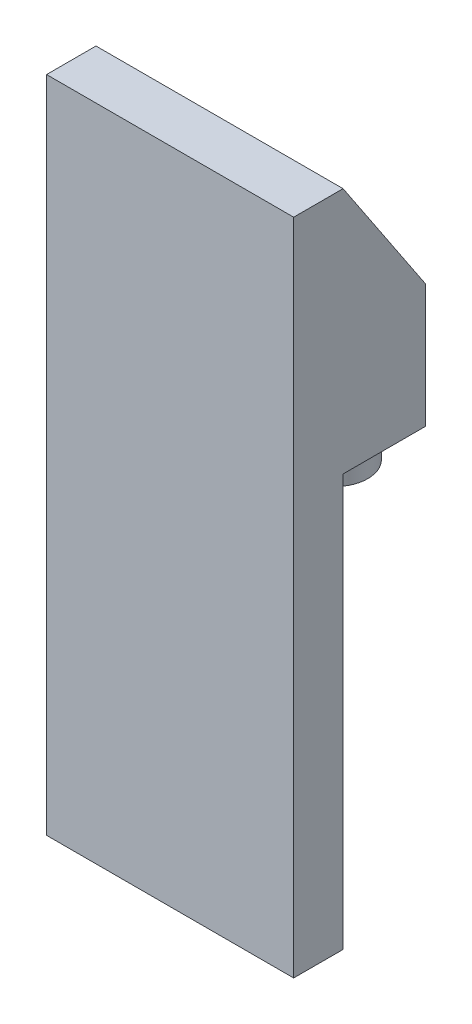
from build123d import *

# Parameters (mm, degrees)
SKETCH1_W           = 15
SKETCH1_H           = 40
BOSS_EXTRUDE2_DEPTH = 3
SKETCH2_W           = 15
SKETCH2_H           = 15
BOSS_EXTRUDE5_DEPTH = 5
CUT_EXTRUDE9_DEPTH  = 15
SKETCH14_W          = 11
SKETCH14_H          = 0.5
CUT_EXTRUDE10_DEPTH = 5
BOSS_EXTRUDE9_DEPTH = 2
SKETCH18_R          = 1.5
CUT_EXTRUDE11_DEPTH = 10


with BuildPart() as part:
    # Sketch1 → Boss-Extrude2 (new body)
    with BuildSketch(Plane.XY):
        with Locations((0.416666667, -8.072916667)):
            Rectangle(SKETCH1_W, SKETCH1_H)
    extrude(amount=BOSS_EXTRUDE2_DEPTH)

    # Sketch2 → Boss-Extrude5 (add)
    with BuildSketch(Plane(origin=(0, 0, 0), x_dir=(-1, 0, 0), z_dir=(0, 0, -1))):
        with Locations((-0.416666667, 4.427083333)):
            Rectangle(SKETCH2_W, SKETCH2_H)
    extrude(amount=BOSS_EXTRUDE5_DEPTH)

    # Sketch12 → Cut-Extrude9 (cut)
    with BuildSketch(Plane.ZY.offset(7.083333333)):
        Polygon((-5, 11.927083333), (-5, 4.427083333), (0, 11.927083333), align=None)
    extrude(amount=-CUT_EXTRUDE9_DEPTH, mode=Mode.SUBTRACT)

    # Sketch14 → Cut-Extrude10 (cut)
    with BuildSketch(Plane(origin=(0, 3.669871795, -5.504807692), x_dir=(-1, 0, 0), z_dir=(0, 0.5547001962252293, -0.8320502943378436))):
        with Locations((-0.416666667, 3.160055009)):
            Rectangle(SKETCH14_W, SKETCH14_H)
        with Locations((-0.416666667, 4.160055009)):
            Rectangle(SKETCH14_W, SKETCH14_H)
        with Locations((-0.416666667, 5.160055009)):
            Rectangle(SKETCH14_W, SKETCH14_H)
        with Locations((-0.416666667, 6.160055009)):
            Rectangle(SKETCH14_W, SKETCH14_H)
        with Locations((-0.416666667, 7.160055009)):
            Rectangle(SKETCH14_W, SKETCH14_H)
    extrude(amount=-CUT_EXTRUDE10_DEPTH, mode=Mode.SUBTRACT)

    # Sketch17 → Boss-Extrude9 (add)
    with BuildSketch(Plane(origin=(0, -3.072916667, 0), x_dir=(-1, 0, 0), z_dir=(0, -1, 0))):
        with BuildLine():
            Line((-4.916666667, 4.5), (4.083333333, 4.5))
            ThreePointArc((4.083333333, 4.5), (6.083333333, 2.5), (4.083333333, 0.5))
            Line((4.083333333, 0.5), (-4.916666667, 0.5))
            ThreePointArc((-4.916666667, 0.5), (-6.916666667, 2.5), (-4.916666667, 4.5))
        make_face()
    extrude(amount=BOSS_EXTRUDE9_DEPTH)

    # Sketch18 → Cut-Extrude11 (cut)
    with BuildSketch(Plane.XZ.offset(5.072916667)):
        with Locations(Location((-4.083333333, -2.5, 0), (0, 0, 270))):
            Circle(SKETCH18_R)
        with Locations(Location((4.916666667, -2.5, 0), (0, 0, 270))):
            Circle(SKETCH18_R)
        with Locations(Location((0.416666667, -2.5, 0), (0, 0, 270))):
            Circle(SKETCH18_R)
    extrude(amount=-CUT_EXTRUDE11_DEPTH, mode=Mode.SUBTRACT)


solid = part.part
